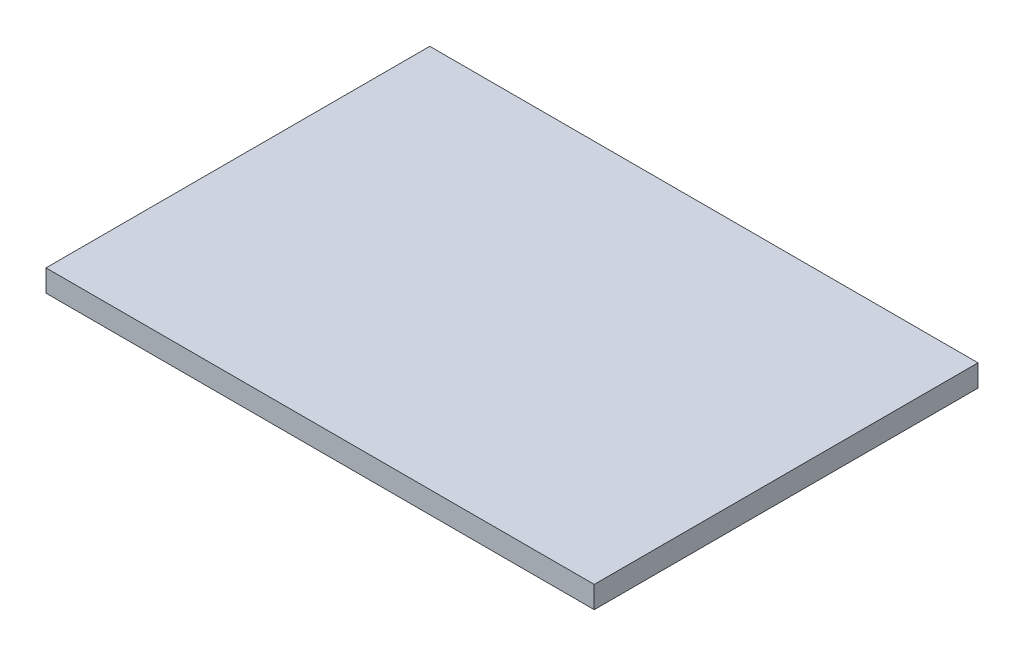
from build123d import *

# Parameters (mm, degrees)
SKETCH1_W           = 50
SKETCH1_H           = 35
BOSS_EXTRUDE1_DEPTH = 2


with BuildPart() as part:
    # Sketch1 → Boss-Extrude1 (new body)
    with BuildSketch(Plane(origin=(0, 0, 0), x_dir=(1, 0, 0), z_dir=(0, 1, 0))):
        Rectangle(SKETCH1_W, SKETCH1_H)
    extrude(amount=BOSS_EXTRUDE1_DEPTH)


solid = part.part
